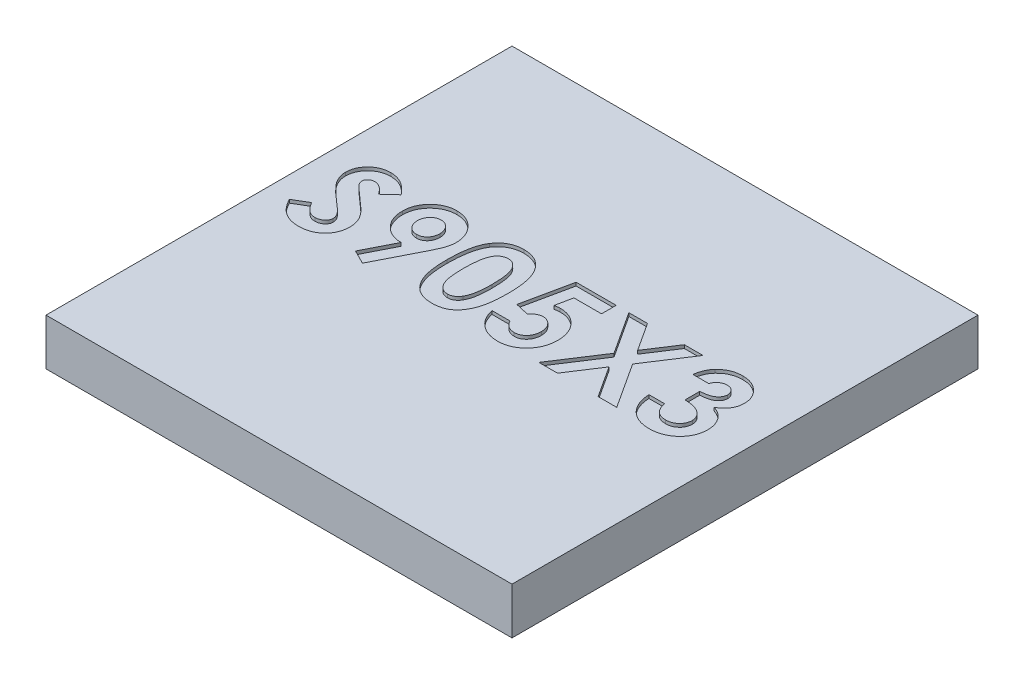
from build123d import *

# Parameters (mm, degrees)
ESQUISSE1_W             = 14
ESQUISSE1_H             = 14
BOSS_EXTRU_1_DEPTH      = 1.4
ENL_V_MAT_EXTRU_1_DEPTH = 0.1


with BuildPart() as part:
    # Esquisse1 → Boss.-Extru.1 (new body)
    with BuildSketch(Plane(origin=(0, 0, 0), x_dir=(1, 0, 0), z_dir=(0, 1, 0))):
        with Locations((7, 7)):
            Rectangle(ESQUISSE1_W, ESQUISSE1_H)
    extrude(amount=BOSS_EXTRU_1_DEPTH)

    # Esquisse2 → Enlèv. mat.-Extru.1 (cut)
    # profile 1 of 6: a face of its own
    with BuildSketch(Plane(origin=(0, 1.4, 0), x_dir=(1, 0, 0), z_dir=(0, 1, 0))):
        with BuildLine():
            Line((2.20538927, 8.465128817), (1.850279428, 8.140229812))
            add(Edge.make_bspline(
                [(1.850279428, 8.140229812), (1.835068045, 8.161687049), (1.805864311, 8.202881952), (1.758528104, 8.258042898), (1.711405644, 8.30509929), (1.664060371, 8.343854548), (1.616072634, 8.374073205), (1.567525732, 8.395468348), (1.518694891, 8.409069443), (1.485888104, 8.410763107), (1.46972888, 8.411597333)],
                knots=[0, 0, 0, 0, 1.299362458, 2.494594718, 3.587462134, 4.587049575, 5.512617175, 6.380583204, 7.202344345, 8, 8, 8, 8], degree=3))
            add(Edge.make_bspline(
                [(1.46972888, 8.411597333), (1.454656019, 8.411068729), (1.425554285, 8.410048133), (1.384067604, 8.399903488), (1.347235137, 8.382395319), (1.315092833, 8.359501915), (1.289631385, 8.331920671), (1.269302394, 8.302995038), (1.257855463, 8.271067681), (1.256348822, 8.249138684), (1.255602945, 8.23828253)],
                knots=[0, 0, 0, 0, 1.185010067, 2.2879431, 3.333075148, 4.379039566, 5.372662701, 6.27520591, 7.14612461, 8, 8, 8, 8], degree=3))
            add(Edge.make_bspline(
                [(1.255602945, 8.23828253), (1.256070349, 8.227269825), (1.257011634, 8.205091768), (1.266103166, 8.172587063), (1.279806701, 8.140826182), (1.292900988, 8.121491823), (1.299594165, 8.111609019)],
                knots=[0, 0, 0, 0, 0.967525499, 1.948461899, 2.951351359, 4, 4, 4, 4], degree=3))
            add(Edge.make_bspline(
                [(1.299594165, 8.111609019), (1.305678986, 8.103927218), (1.319685441, 8.086244728), (1.346392883, 8.058238421), (1.379931821, 8.023928242), (1.421592903, 7.98449402), (1.469646665, 7.938517544), (1.526320459, 7.887806168), (1.589982967, 7.83078942), (1.635232803, 7.791085021), (1.658944125, 7.770279558)],
                knots=[0, 0, 0, 0, 0.473873513, 1.090794244, 1.870441696, 2.795289791, 3.865433203, 5.087734844, 6.473946851, 8, 8, 8, 8], degree=3))
            add(Edge.make_bspline(
                [(1.658944125, 7.770279558), (1.68120061, 7.751017692), (1.723438796, 7.714462673), (1.783535347, 7.662578692), (1.836350207, 7.615899939), (1.882652766, 7.575126963), (1.921741125, 7.539831962), (1.953779609, 7.509846226), (1.979159516, 7.485753522), (1.993586507, 7.471201514), (1.99974357, 7.464991097)],
                knots=[0, 0, 0, 0, 1.543621617, 2.929473131, 4.163658386, 5.240097082, 6.164993805, 6.925417477, 7.541396219, 8, 8, 8, 8], degree=3))
            add(Edge.make_bspline(
                [(1.99974357, 7.464991097), (2.023102185, 7.439712073), (2.068005645, 7.391116912), (2.126364314, 7.315809696), (2.174395386, 7.242294497), (2.211553134, 7.169188009), (2.23961616, 7.095435449), (2.259400965, 7.019228041), (2.271250216, 6.939769464), (2.27256576, 6.885548685), (2.27323115, 6.858124276)],
                knots=[0, 0, 0, 0, 1.206664779, 2.319633467, 3.337109185, 4.282041471, 5.190008762, 6.099243693, 7.03861361, 8, 8, 8, 8], degree=3))
            add(Edge.make_bspline(
                [(2.27323115, 6.858124276), (2.272757542, 6.831402553), (2.271828306, 6.778973537), (2.260446938, 6.702251482), (2.244217775, 6.628825146), (2.219124643, 6.559493511), (2.188541282, 6.493118518), (2.150200622, 6.430734081), (2.105174774, 6.371708842), (2.053568238, 6.31709795), (1.996485282, 6.26754235), (1.935258387, 6.223426785), (1.869288845, 6.187003767), (1.799140289, 6.15701201), (1.724850269, 6.133911957), (1.646507286, 6.116838865), (1.56399151, 6.106591865), (1.507566033, 6.105520662), (1.47873913, 6.104973402)],
                knots=[0, 0, 0, 0, 1.043214005, 2.046824704, 3.02475056, 3.976699089, 4.921714032, 5.875962561, 6.831408892, 7.817874052, 8.806269674, 9.781291748, 10.760897367, 11.74438705, 12.757449933, 13.795994037, 14.874007457, 16, 16, 16, 16], degree=3))
            add(Edge.make_bspline(
                [(1.47873913, 6.104973402), (1.456110256, 6.105374853), (1.411292109, 6.106169957), (1.345236936, 6.112661317), (1.2814532, 6.123137683), (1.220012746, 6.138153444), (1.160638775, 6.15718045), (1.103328849, 6.180421209), (1.048478597, 6.208235943), (0.995672995, 6.240052673), (0.945168745, 6.276996086), (0.89632724, 6.318310888), (0.849633621, 6.364632519), (0.804863626, 6.415851429), (0.762303707, 6.472112659), (0.720560726, 6.532632666), (0.681489866, 6.598534621), (0.657354057, 6.644765374), (0.645026022, 6.668379017)],
                knots=[0, 0, 0, 0, 1.016823716, 2.013894106, 2.979844003, 3.91962641, 4.853723003, 5.779685073, 6.695824784, 7.614987388, 8.547259901, 9.504950863, 10.487499108, 11.500346958, 12.559593716, 13.656357062, 14.802919212, 16, 16, 16, 16], degree=3))
            Line((0.645026022, 6.668379017), (1.062677598, 6.919075966))
            add(Edge.make_bspline(
                [(1.062677598, 6.919075966), (1.078098128, 6.892271396), (1.1076606, 6.840884744), (1.157756975, 6.771840265), (1.209078152, 6.712715098), (1.262810633, 6.664554283), (1.318301051, 6.62671385), (1.375817436, 6.59967045), (1.4354002, 6.582930617), (1.475985272, 6.580886297), (1.496229615, 6.579866564)],
                knots=[0, 0, 0, 0, 1.283663364, 2.460892379, 3.537111102, 4.529833553, 5.449777664, 6.316464042, 7.160231139, 8, 8, 8, 8], degree=3))
            add(Edge.make_bspline(
                [(1.496229615, 6.579866564), (1.51682101, 6.580699333), (1.556771315, 6.582315026), (1.613795264, 6.597238696), (1.66607698, 6.620669952), (1.711268909, 6.654103123), (1.749534585, 6.692690084), (1.77777685, 6.735619842), (1.795518832, 6.782068805), (1.797394589, 6.81433531), (1.798337988, 6.830563512)],
                knots=[0, 0, 0, 0, 1.13588714, 2.203786484, 3.234766741, 4.283437687, 5.291419208, 6.222934724, 7.106237994, 8, 8, 8, 8], degree=3))
            add(Edge.make_bspline(
                [(1.798337988, 6.830563512), (1.797466798, 6.845661214), (1.795697059, 6.876330751), (1.782661707, 6.92193142), (1.762283475, 6.96751135), (1.738174589, 7.004897242), (1.71364078, 7.036199436), (1.690180924, 7.063321371), (1.661613026, 7.093286362), (1.628009521, 7.1261321), (1.589814398, 7.162147737), (1.546995484, 7.201329746), (1.499062457, 7.243332978), (1.465183299, 7.271945166), (1.447468263, 7.286906161)],
                knots=[0, 0, 0, 0, 0.916159276, 1.861089862, 2.860218735, 3.940849679, 4.552606315, 5.27541173, 6.11797699, 7.06649574, 8.129236253, 9.306560635, 10.591630461, 12, 12, 12, 12], degree=3))
            add(Edge.make_bspline(
                [(1.447468263, 7.286906161), (1.413791275, 7.315400122), (1.349154942, 7.370088658), (1.257815603, 7.450861904), (1.17551068, 7.526351903), (1.102951047, 7.597491878), (1.039212181, 7.662968037), (0.984725751, 7.723312203), (0.940090315, 7.778989848), (0.893121142, 7.844936294), (0.848491037, 7.925296569), (0.809917962, 8.021979295), (0.784893379, 8.118649754), (0.782089722, 8.183548976), (0.780709783, 8.215491898)],
                knots=[0, 0, 0, 0, 1.345494975, 2.582412109, 3.71882943, 4.751509156, 5.681369928, 6.505683931, 7.230279997, 7.856715994, 8.973648664, 10.023341002, 11.027102913, 12, 12, 12, 12], degree=3))
            add(Edge.make_bspline(
                [(0.780709783, 8.215491898), (0.781283698, 8.238144103), (0.782414372, 8.282771382), (0.792500158, 8.348389292), (0.80757375, 8.411705062), (0.829464932, 8.472487687), (0.857877044, 8.530661035), (0.89238245, 8.586509887), (0.933516954, 8.639520225), (0.979872763, 8.689656905), (1.030944996, 8.735476126), (1.085522167, 8.775916179), (1.143295365, 8.810072436), (1.203911163, 8.838407531), (1.267745171, 8.860096246), (1.334327127, 8.875470289), (1.403752531, 8.884614279), (1.450974192, 8.885857298), (1.475029027, 8.886490496)],
                knots=[0, 0, 0, 0, 1.010766082, 1.991317756, 2.957454644, 3.913069143, 4.869106762, 5.843196583, 6.838735724, 7.860187025, 8.887984031, 9.89767229, 10.887916223, 11.879572884, 12.879850636, 13.892031539, 14.926195476, 16, 16, 16, 16], degree=3))
            add(Edge.make_bspline(
                [(1.475029027, 8.886490496), (1.506202903, 8.885350089), (1.568304578, 8.883078277), (1.660123696, 8.865313453), (1.749808772, 8.837376395), (1.822078687, 8.803673409), (1.879582509, 8.77102531), (1.923653817, 8.740967054), (1.968498746, 8.706533705), (2.014478941, 8.667616756), (2.060740019, 8.62348296), (2.108597404, 8.575182957), (2.157398981, 8.522299322), (2.189112269, 8.484519498), (2.20538927, 8.465128817)],
                knots=[0, 0, 0, 0, 1.282922637, 2.555718331, 3.837320111, 5.142675274, 5.830281639, 6.55870424, 7.337177975, 8.157850921, 9.037902056, 9.96903443, 10.957596896, 12, 12, 12, 12], degree=3))
        make_face()
    # profile 2 of 6: a face of its own
    with BuildSketch(Plane(origin=(0, 1.4, 0), x_dir=(1, 0, 0), z_dir=(0, 1, 0))):
        with BuildLine():
            Line((3.40322247, 6.104973402), (2.982390806, 6.316979278))
            Line((2.982390806, 6.316979278), (3.443503586, 7.224364427))
            add(Edge.make_bspline(
                [(3.443503586, 7.224364427), (3.416259985, 7.22505883), (3.362774203, 7.226422112), (3.284020563, 7.237750969), (3.208710352, 7.25709005), (3.135955913, 7.282835239), (3.066763415, 7.317349333), (3.000293845, 7.358540093), (2.937467365, 7.408030198), (2.877989409, 7.463659123), (2.823684135, 7.525147092), (2.776548306, 7.591276362), (2.735464009, 7.660369427), (2.703514606, 7.733986113), (2.677852683, 7.810754388), (2.659102788, 7.891071613), (2.648580843, 7.975290169), (2.647110173, 8.032608396), (2.646361492, 8.061787638)],
                knots=[0, 0, 0, 0, 1.014336294, 1.991387562, 2.955278539, 3.906441712, 4.859855302, 5.829322156, 6.813833455, 7.833278715, 8.858926674, 9.863225732, 10.85404919, 11.846815163, 12.845559416, 13.865450493, 14.913355531, 16, 16, 16, 16], degree=3))
            add(Edge.make_bspline(
                [(2.646361492, 8.061787638), (2.647055934, 8.090091214), (2.648424318, 8.145862826), (2.659788874, 8.227717403), (2.678491993, 8.306309755), (2.704152003, 8.381626531), (2.738312005, 8.453159857), (2.778295418, 8.522029779), (2.827173326, 8.586811452), (2.882388734, 8.647785316), (2.942819068, 8.703565636), (3.00693058, 8.752610169), (3.074431763, 8.793606685), (3.144455162, 8.828036196), (3.218266499, 8.853759785), (3.294799119, 8.873168042), (3.374623138, 8.884369381), (3.428806018, 8.8857778), (3.456223939, 8.886490496)],
                knots=[0, 0, 0, 0, 1.055538678, 2.079917126, 3.075849687, 4.065898488, 5.041806164, 6.028602842, 7.031727914, 8.062953097, 9.093756959, 10.095582084, 11.068815425, 12.035667573, 13.000833448, 13.979119574, 14.977382875, 16, 16, 16, 16], degree=3))
            add(Edge.make_bspline(
                [(3.456223939, 8.886490496), (3.484892692, 8.88590038), (3.541265917, 8.884739998), (3.623788747, 8.871935642), (3.702743251, 8.852291417), (3.778450233, 8.825610553), (3.849969824, 8.789399097), (3.917900462, 8.745999415), (3.982016188, 8.69445126), (4.041628447, 8.63624041), (4.09584513, 8.57292522), (4.143901473, 8.50664949), (4.184270842, 8.437542808), (4.217335825, 8.366221928), (4.24309328, 8.292575116), (4.260798247, 8.216497909), (4.272552382, 8.1381204), (4.273889768, 8.084974657), (4.274566621, 8.058077535)],
                knots=[0, 0, 0, 0, 1.062826075, 2.08990367, 3.089830715, 4.078784409, 5.060762809, 6.057138927, 7.064407536, 8.107320944, 9.143871033, 10.153461498, 11.140480137, 12.108246174, 13.065926856, 14.029354859, 15.002654194, 16, 16, 16, 16], degree=3))
            add(Edge.make_bspline(
                [(4.274566621, 8.058077535), (4.274197256, 8.037563738), (4.273453272, 7.996244339), (4.26613786, 7.934281422), (4.255038905, 7.872146768), (4.242156218, 7.819906935), (4.228650514, 7.775871929), (4.215507925, 7.738516393), (4.198645597, 7.697044733), (4.179817122, 7.651178976), (4.158011532, 7.601120248), (4.132776729, 7.547107849), (4.105637834, 7.488340721), (4.085633789, 7.448156561), (4.075281097, 7.427360054)],
                knots=[0, 0, 0, 0, 1.105131805, 2.225983929, 3.357782449, 4.505488967, 5.122909461, 5.839607681, 6.638776516, 7.535249922, 8.51168636, 9.581005249, 10.748097757, 12, 12, 12, 12], degree=3))
            Line((4.075281097, 7.427360054), (3.40322247, 6.104973402))
        make_face()
        with BuildLine():
            add(Edge.make_bspline(
                [(3.466824233, 7.665336649), (3.489579135, 7.666676296), (3.53403706, 7.669293663), (3.597897915, 7.689531702), (3.655050132, 7.724164483), (3.705706217, 7.770174593), (3.747566855, 7.826309033), (3.778002279, 7.890213102), (3.796749562, 7.960563419), (3.798680105, 8.009550675), (3.799673458, 8.034756889)],
                knots=[0, 0, 0, 0, 0.984774978, 1.924027336, 2.867853169, 3.859505234, 4.871392407, 5.881338128, 6.909850265, 8, 8, 8, 8], degree=3))
            add(Edge.make_bspline(
                [(3.799673458, 8.034756889), (3.798477072, 8.06048745), (3.796149816, 8.110539535), (3.777222941, 8.182578529), (3.744880718, 8.247697506), (3.700880974, 8.304303831), (3.649511846, 8.351676093), (3.592068196, 8.386280255), (3.529944873, 8.40767836), (3.48695336, 8.410281988), (3.465234189, 8.411597333)],
                knots=[0, 0, 0, 0, 1.104110315, 2.147758178, 3.172670271, 4.206310416, 5.210906102, 6.157051016, 7.068948237, 8, 8, 8, 8], degree=3))
            add(Edge.make_bspline(
                [(3.465234189, 8.411597333), (3.442278244, 8.410315042), (3.397204435, 8.407797273), (3.332550402, 8.386450555), (3.272949534, 8.352510908), (3.220901449, 8.304977914), (3.175855828, 8.249117076), (3.144444287, 8.183778293), (3.124572257, 8.112242016), (3.122380406, 8.062100171), (3.121254655, 8.036346933)],
                knots=[0, 0, 0, 0, 0.970967322, 1.90648639, 2.855811969, 3.858352357, 4.877096915, 5.878517833, 6.91039038, 8, 8, 8, 8], degree=3))
            add(Edge.make_bspline(
                [(3.121254655, 8.036346933), (3.122430572, 8.010960788), (3.124717608, 7.961587386), (3.143885293, 7.890838086), (3.175107533, 7.826595831), (3.217790562, 7.770018691), (3.270365543, 7.723781884), (3.330060385, 7.689518013), (3.396648602, 7.669238788), (3.443011276, 7.666660777), (3.466824233, 7.665336649)],
                knots=[0, 0, 0, 0, 1.075706617, 2.092137047, 3.084482865, 4.090466434, 5.0784141, 6.035155512, 6.990809768, 8, 8, 8, 8], degree=3))
        make_face(mode=Mode.SUBTRACT)
    # profile 3 of 6: a face of its own
    with BuildSketch(Plane(origin=(0, 1.4, 0), x_dir=(1, 0, 0), z_dir=(0, 1, 0))):
        with BuildLine():
            add(Edge.make_bspline(
                [(5.470809776, 8.886490496), (5.493796576, 8.88614925), (5.538994767, 8.88547827), (5.605563194, 8.878211012), (5.669686994, 8.867232211), (5.731617028, 8.851920612), (5.790907516, 8.831656256), (5.847989988, 8.807400169), (5.902184996, 8.77788007), (5.954183701, 8.744535602), (6.003966071, 8.706784937), (6.050335624, 8.66374723), (6.094139165, 8.61641278), (6.134428508, 8.564065975), (6.172095875, 8.507182965), (6.207017496, 8.44575473), (6.238926037, 8.37948062), (6.268179117, 8.308241038), (6.294337314, 8.230968134), (6.31637033, 8.146775554), (6.335267329, 8.05564407), (6.351217729, 7.957346844), (6.363273653, 7.851753213), (6.371399589, 7.738933331), (6.376975991, 7.619104696), (6.377431098, 7.536903237), (6.377664911, 7.494671919)],
                knots=[0, 0, 0, 0, 0.879237366, 1.728815576, 2.559023295, 3.367336655, 4.166867292, 4.954216142, 5.737608147, 6.525189134, 7.316157332, 8.124696809, 8.942788509, 9.781158001, 10.649253743, 11.551476218, 12.482711956, 13.461909668, 14.496590415, 15.601789533, 16.789733467, 18.056700938, 19.410929216, 20.8549011, 22.384193279, 24, 24, 24, 24], degree=3))
            add(Edge.make_bspline(
                [(6.377664911, 7.494671919), (6.377412222, 7.451912241), (6.376921253, 7.368830952), (6.371631402, 7.247906303), (6.362522029, 7.134267281), (6.350781211, 7.02792564), (6.334699502, 6.92893754), (6.315865586, 6.837046667), (6.293484785, 6.752286329), (6.266464946, 6.67484751), (6.237388935, 6.603482816), (6.20539311, 6.537337925), (6.171035154, 6.47623368), (6.135103135, 6.41924824), (6.095627127, 6.368061507), (6.054528538, 6.320932865), (6.010017864, 6.279657504), (5.963969174, 6.242108277), (5.91469552, 6.20965821), (5.862705048, 6.181277916), (5.807070858, 6.158258127), (5.748807067, 6.138236744), (5.686920556, 6.123863551), (5.622394693, 6.112458895), (5.554500996, 6.106155983), (5.508276232, 6.105374065), (5.484590158, 6.104973402)],
                knots=[0, 0, 0, 0, 1.643780988, 3.193836972, 4.651895693, 6.025988579, 7.305620092, 8.505800249, 9.631074763, 10.672816429, 11.65661981, 12.592235626, 13.49536222, 14.350718032, 15.179365177, 15.97804903, 16.751647189, 17.51006938, 18.259804725, 19.016521909, 19.783502495, 20.571750527, 21.382245291, 22.22305063, 23.089471752, 24, 24, 24, 24], degree=3))
            add(Edge.make_bspline(
                [(5.484590158, 6.104973402), (5.460904724, 6.105381793), (5.414505307, 6.106181827), (5.346428018, 6.11241203), (5.281560201, 6.123909752), (5.219184068, 6.138347091), (5.159733748, 6.158213828), (5.102924177, 6.181922352), (5.049192173, 6.210125567), (4.998388959, 6.24265124), (4.950687993, 6.279949235), (4.905348002, 6.321620606), (4.86246928, 6.367559728), (4.822704119, 6.418281158), (4.78540128, 6.47310787), (4.750949775, 6.532665957), (4.719370306, 6.596868706), (4.689675062, 6.665805609), (4.663873654, 6.740960796), (4.640911599, 6.823005396), (4.622101688, 6.912623317), (4.606973499, 7.009785769), (4.594895161, 7.114286908), (4.585910266, 7.226177175), (4.580591032, 7.345508685), (4.580105211, 7.427531176), (4.579855082, 7.469761229)],
                knots=[0, 0, 0, 0, 0.917216111, 1.796812873, 2.643793957, 3.46689424, 4.273913431, 5.068098542, 5.848489301, 6.620921603, 7.401012384, 8.190319798, 9.003608147, 9.831726257, 10.68377682, 11.569763213, 12.493818149, 13.453288342, 14.474581811, 15.568529029, 16.750744269, 18.018426408, 19.375425659, 20.823733699, 22.36466933, 24, 24, 24, 24], degree=3))
            add(Edge.make_bspline(
                [(4.579855082, 7.469761229), (4.580308168, 7.528436563), (4.581182403, 7.641651377), (4.592261354, 7.805213866), (4.608522445, 7.956399053), (4.632406134, 8.094954044), (4.661937986, 8.221392006), (4.69975506, 8.334880031), (4.742807048, 8.436988481), (4.779492873, 8.497478142), (4.797161105, 8.526610521)],
                knots=[0, 0, 0, 0, 1.288568992, 2.486310467, 3.599230591, 4.627010532, 5.572937695, 6.447898582, 7.252493626, 8, 8, 8, 8], degree=3))
            add(Edge.make_bspline(
                [(4.797161105, 8.526610521), (4.817704884, 8.555230161), (4.857872019, 8.611187197), (4.928105377, 8.684648325), (5.003561976, 8.747475879), (5.085791652, 8.798248016), (5.173493908, 8.838286927), (5.267421712, 8.866565958), (5.367228205, 8.88304264), (5.435766988, 8.885324048), (5.470809776, 8.886490496)],
                knots=[0, 0, 0, 0, 1.058512271, 2.069600068, 3.047294572, 4.004278952, 4.967380941, 5.939006123, 6.946246673, 8, 8, 8, 8], degree=3))
        make_face()
        with BuildLine():
            add(Edge.make_bspline(
                [(5.482470099, 8.411597333), (5.461689842, 8.41061239), (5.420949505, 8.408681379), (5.361833336, 8.392289821), (5.30609048, 8.366972175), (5.263688378, 8.336506346), (5.231950826, 8.307301196), (5.209775571, 8.280871485), (5.188391033, 8.251377833), (5.169503131, 8.217489341), (5.151668022, 8.180423665), (5.134237745, 8.140012548), (5.119949494, 8.095263405), (5.105911667, 8.04693832), (5.09361322, 7.993701233), (5.083309818, 7.93511699), (5.074104634, 7.870804612), (5.067683908, 7.800721974), (5.061697865, 7.7249424), (5.057406785, 7.643297082), (5.055612793, 7.555808046), (5.055042537, 7.495555646), (5.054748244, 7.464461082)],
                knots=[0, 0, 0, 0, 1.076674018, 2.110852608, 3.161083442, 4.239746716, 4.804137807, 5.395870207, 6.026861976, 6.692161227, 7.405688833, 8.16177676, 8.973626916, 9.841385931, 10.773283133, 11.807421078, 12.927755683, 14.143907515, 15.458935494, 16.872852025, 18.386167141, 20, 20, 20, 20], degree=3))
            add(Edge.make_bspline(
                [(5.054748244, 7.464461082), (5.055232615, 7.424176571), (5.056161431, 7.346928034), (5.061026135, 7.235841948), (5.070777031, 7.134744665), (5.082905176, 7.042951011), (5.099939652, 6.961056293), (5.119538918, 6.88828571), (5.14374227, 6.825566911), (5.171713907, 6.771992841), (5.202693755, 6.72641749), (5.236323742, 6.687678237), (5.271458889, 6.654131872), (5.309195877, 6.626882573), (5.349444678, 6.605999966), (5.391869287, 6.590979365), (5.436496665, 6.581784629), (5.467057034, 6.580509615), (5.482470099, 6.579866564)],
                knots=[0, 0, 0, 0, 1.771748488, 3.397459088, 4.888034009, 6.237357457, 7.467047327, 8.564189669, 9.548206622, 10.417051504, 11.216568818, 11.965764335, 12.669334354, 13.348544111, 14.005342236, 14.656555988, 15.322436492, 16, 16, 16, 16], degree=3))
            add(Edge.make_bspline(
                [(5.482470099, 6.579866564), (5.497354237, 6.580306587), (5.526495529, 6.581168098), (5.568990058, 6.590011392), (5.609175904, 6.604388668), (5.646931734, 6.624726333), (5.682392595, 6.650588786), (5.715385176, 6.682089678), (5.745660653, 6.719542999), (5.763299284, 6.747338902), (5.772388135, 6.761661603)],
                knots=[0, 0, 0, 0, 0.992283464, 1.942767638, 2.88273346, 3.832339453, 4.79467288, 5.803907806, 6.868395428, 8, 8, 8, 8], degree=3))
            add(Edge.make_bspline(
                [(5.772388135, 6.761661603), (5.783088726, 6.781233115), (5.805526999, 6.82227299), (5.831492607, 6.891526249), (5.853349008, 6.969632479), (5.872160493, 7.056834754), (5.885026401, 7.15347701), (5.896106506, 7.258946432), (5.901450715, 7.373774119), (5.90231998, 7.453327155), (5.902771749, 7.494671919)],
                knots=[0, 0, 0, 0, 0.710965849, 1.490837728, 2.352621235, 3.297892224, 4.334225155, 5.461620853, 6.680770821, 8, 8, 8, 8], degree=3))
            add(Edge.make_bspline(
                [(5.902771749, 7.494671919), (5.90259724, 7.536375576), (5.902261342, 7.616647995), (5.896098571, 7.731888496), (5.887516441, 7.837141568), (5.874963263, 7.932172223), (5.858811318, 8.017211155), (5.838903985, 8.092252804), (5.81543472, 8.157445063), (5.787602969, 8.212722926), (5.756777575, 8.259701526), (5.724055479, 8.300005522), (5.689298317, 8.334416056), (5.652564216, 8.363062622), (5.613002951, 8.384950748), (5.571370195, 8.400405575), (5.527580596, 8.409755227), (5.497709891, 8.41097501), (5.482470099, 8.411597333)],
                knots=[0, 0, 0, 0, 1.793836731, 3.452829483, 4.963243077, 6.335886805, 7.574563692, 8.684454726, 9.672768357, 10.54971625, 11.340229787, 12.085688095, 12.778991901, 13.440269426, 14.083255152, 14.715733572, 15.344777694, 16, 16, 16, 16], degree=3))
        make_face(mode=Mode.SUBTRACT)
    # profile 4 of 6: a face of its own
    with BuildSketch(Plane(origin=(0, 1.4, 0), x_dir=(1, 0, 0), z_dir=(0, 1, 0))):
        with BuildLine():
            Line((7.10643511, 8.818648615), (8.311158501, 8.818648615))
            Line((8.311158501, 8.818648615), (8.311158501, 8.377676393))
            Line((8.311158501, 8.377676393), (7.48274554, 8.377676393))
            Line((7.48274554, 8.377676393), (7.379392676, 7.877342526))
            add(Edge.make_bspline(
                [(7.379392676, 7.877342526), (7.393475983, 7.881264904), (7.421251158, 7.889000641), (7.463094495, 7.896758607), (7.503646519, 7.901787073), (7.53025651, 7.902457804), (7.543167215, 7.902783231)],
                knots=[0, 0, 0, 0, 1.05461699, 2.079921384, 3.068411212, 4, 4, 4, 4], degree=3))
            add(Edge.make_bspline(
                [(7.543167215, 7.902783231), (7.571300994, 7.902138561), (7.62675887, 7.900867776), (7.707886706, 7.888803881), (7.785571402, 7.869803611), (7.859575233, 7.842705305), (7.929825908, 7.807436161), (7.996408585, 7.764770384), (8.059404982, 7.714633036), (8.117696019, 7.656992727), (8.171256259, 7.593702364), (8.217823833, 7.525247138), (8.257595447, 7.452603157), (8.289228413, 7.375318865), (8.314195847, 7.293879661), (8.332237873, 7.208233355), (8.342907024, 7.118278444), (8.344345693, 7.05690864), (8.345079441, 7.025608918)],
                knots=[0, 0, 0, 0, 1.01440847, 1.999622559, 2.951875003, 3.895578053, 4.836219714, 5.782137149, 6.743708247, 7.735272588, 8.734977101, 9.730283169, 10.717124674, 11.717316708, 12.737475749, 13.78628267, 14.87096371, 16, 16, 16, 16], degree=3))
            add(Edge.make_bspline(
                [(8.345079441, 7.025608918), (8.344182789, 6.993953873), (8.342413434, 6.931489214), (8.330870009, 6.83964407), (8.310495658, 6.751677157), (8.282509447, 6.667352989), (8.245639407, 6.587291329), (8.201298137, 6.510662796), (8.148735946, 6.438036182), (8.08846865, 6.370155995), (8.022950193, 6.308112202), (7.953188503, 6.253532158), (7.879673676, 6.207603494), (7.802403939, 6.170485368), (7.721822612, 6.141118167), (7.637905239, 6.119740247), (7.550243991, 6.107481198), (7.490733394, 6.10581852), (7.460484923, 6.104973402)],
                knots=[0, 0, 0, 0, 1.06808661, 2.107647099, 3.116961351, 4.110378221, 5.100014249, 6.085620622, 7.093190682, 8.119403071, 9.144090782, 10.133780668, 11.103064255, 12.062861538, 13.020824475, 13.992378307, 14.979551724, 16, 16, 16, 16], degree=3))
            add(Edge.make_bspline(
                [(7.460484923, 6.104973402), (7.433434616, 6.105664761), (7.380085749, 6.107028265), (7.301505211, 6.115409084), (7.225744845, 6.13022645), (7.153206858, 6.151671016), (7.083128028, 6.17806438), (7.016318486, 6.211074271), (6.952411102, 6.250072134), (6.89158735, 6.294346258), (6.834835529, 6.344219342), (6.78303848, 6.398814025), (6.735882617, 6.457442167), (6.694377002, 6.520827063), (6.658651743, 6.588875065), (6.626969855, 6.66078421), (6.601037912, 6.737305461), (6.587878198, 6.790354243), (6.581190552, 6.817313145)],
                knots=[0, 0, 0, 0, 1.054957082, 2.080596141, 3.077793124, 4.061112343, 5.027190972, 5.994718051, 6.962465889, 7.943658696, 8.924948258, 9.904494768, 10.875059, 11.855380583, 12.854004648, 13.869083016, 14.917087635, 16, 16, 16, 16], degree=3))
            Line((6.581190552, 6.817313145), (7.123925595, 6.817313145))
            add(Edge.make_bspline(
                [(7.123925595, 6.817313145), (7.133846805, 6.798631724), (7.153127543, 6.762326513), (7.189803771, 6.714125892), (7.23086048, 6.673022472), (7.275927315, 6.638614665), (7.325296283, 6.612836922), (7.37695569, 6.593288274), (7.431554512, 6.581991835), (7.468738721, 6.580579668), (7.487515672, 6.579866564)],
                knots=[0, 0, 0, 0, 1.104910296, 2.147267069, 3.153527244, 4.136738762, 5.099945312, 6.05603338, 7.018353, 8, 8, 8, 8], degree=3))
            add(Edge.make_bspline(
                [(7.487515672, 6.579866564), (7.500602956, 6.580358968), (7.526352406, 6.581327782), (7.564290149, 6.586453049), (7.600503392, 6.596160188), (7.635261371, 6.609602319), (7.668657455, 6.626366175), (7.7002129, 6.647529451), (7.730476713, 6.671889166), (7.758988156, 6.699842022), (7.784811306, 6.731002954), (7.807455383, 6.7644875), (7.827702311, 6.799551626), (7.842699521, 6.837584309), (7.854980967, 6.877449881), (7.86402552, 6.91944906), (7.869430661, 6.963630897), (7.869931033, 6.993792599), (7.870186279, 7.009178463)],
                knots=[0, 0, 0, 0, 0.978869489, 1.925942215, 2.855067702, 3.774946051, 4.70828698, 5.642468714, 6.60995405, 7.609372294, 8.622401667, 9.629904756, 10.629323, 11.642352373, 12.678539694, 13.745912462, 14.850161547, 16, 16, 16, 16], degree=3))
            add(Edge.make_bspline(
                [(7.870186279, 7.009178463), (7.869890036, 7.024207186), (7.869313394, 7.053460961), (7.86454329, 7.096415981), (7.856009666, 7.13717252), (7.844382529, 7.176042745), (7.829498407, 7.212790616), (7.811309015, 7.247634874), (7.789736645, 7.280399393), (7.764665481, 7.310417122), (7.73792985, 7.337950236), (7.709207191, 7.362030478), (7.678756281, 7.382015408), (7.647523343, 7.399462832), (7.614261671, 7.412160688), (7.579719188, 7.420905232), (7.543932218, 7.427321627), (7.519522702, 7.427698614), (7.507126216, 7.427890068)],
                knots=[0, 0, 0, 0, 1.166249705, 2.270133367, 3.348514167, 4.393962215, 5.415026464, 6.420877785, 7.440098956, 8.453121383, 9.451844239, 10.415694839, 11.355045125, 12.27538808, 13.187007209, 14.108269027, 15.039275622, 16, 16, 16, 16], degree=3))
            add(Edge.make_bspline(
                [(7.507126216, 7.427890068), (7.493660751, 7.427379129), (7.46667307, 7.426355096), (7.426576131, 7.418022817), (7.38696265, 7.404538063), (7.347612334, 7.385933708), (7.308915805, 7.361586478), (7.269851841, 7.333029969), (7.231727998, 7.298189278), (7.207487797, 7.272239853), (7.194947563, 7.258815382)],
                knots=[0, 0, 0, 0, 0.88288272, 1.769486374, 2.674910571, 3.623812639, 4.617874466, 5.670434592, 6.794841017, 8, 8, 8, 8], degree=3))
            Line((7.194947563, 7.258815382), (6.795316487, 7.350507924))
            Line((6.795316487, 7.350507924), (7.10643511, 8.818648615))
        make_face()
    # profile 5 of 6: a face of its own
    with BuildSketch(Plane(origin=(0, 1.4, 0), x_dir=(1, 0, 0), z_dir=(0, 1, 0))):
        Polygon((8.692239063, 8.818648615), (9.251934576, 8.818648615), (9.804739898, 7.969035067), (10.358605249, 8.818648615), (10.918830777, 8.818648615), (10.084587654, 7.539193153), (10.973952304, 6.172815282), (10.414256791, 6.172815282), (9.804739898, 7.109881254), (9.19363296, 6.172815282), (8.633407433, 6.172815282), (9.524892141, 7.539723168), align=None)
    # profile 6 of 6: a face of its own
    with BuildSketch(Plane(origin=(0, 1.4, 0), x_dir=(1, 0, 0), z_dir=(0, 1, 0))):
        with BuildLine():
            Line((11.737173458, 8.174150752), (11.262280296, 8.174150752))
            add(Edge.make_bspline(
                [(11.262280296, 8.174150752), (11.265633222, 8.197888967), (11.272206412, 8.244426165), (11.287935177, 8.311800435), (11.306748476, 8.375709541), (11.33023592, 8.435951096), (11.35778287, 8.49263241), (11.389109205, 8.545947985), (11.424553574, 8.595668982), (11.451722059, 8.625621108), (11.465275922, 8.640563679)],
                knots=[0, 0, 0, 0, 1.111473889, 2.178970933, 3.205615836, 4.199322666, 5.174200091, 6.12565194, 7.064921805, 8, 8, 8, 8], degree=3))
            add(Edge.make_bspline(
                [(11.465275922, 8.640563679), (11.484825574, 8.66027932), (11.523355883, 8.699136775), (11.587744549, 8.748908882), (11.655235762, 8.791983257), (11.727183088, 8.826132932), (11.802466973, 8.853773138), (11.881686099, 8.872339127), (11.964516749, 8.884657825), (12.021038247, 8.885871259), (12.049882125, 8.886490496)],
                knots=[0, 0, 0, 0, 1.01925491, 2.00884431, 2.983262333, 3.955970413, 4.92937149, 5.924503185, 6.940838805, 8, 8, 8, 8], degree=3))
            add(Edge.make_bspline(
                [(12.049882125, 8.886490496), (12.075525817, 8.885885098), (12.125936148, 8.884695009), (12.200026651, 8.875141619), (12.270665745, 8.858386038), (12.338600106, 8.83647849), (12.402830641, 8.806669611), (12.46477498, 8.772067847), (12.522702396, 8.729627345), (12.576748428, 8.681673849), (12.626400017, 8.629807448), (12.66939851, 8.574366532), (12.706365087, 8.516832054), (12.736820656, 8.456726011), (12.76023685, 8.393946698), (12.776488384, 8.328856782), (12.787125407, 8.261599888), (12.788185132, 8.215886283), (12.788722603, 8.192701266)],
                knots=[0, 0, 0, 0, 1.091422571, 2.145516843, 3.172569842, 4.178562979, 5.178154469, 6.181868002, 7.194278174, 8.227918432, 9.254613415, 10.245994977, 11.209837596, 12.161663635, 13.10878368, 14.055455738, 15.013766427, 16, 16, 16, 16], degree=3))
            add(Edge.make_bspline(
                [(12.788722603, 8.192701266), (12.78761968, 8.163988553), (12.785448363, 8.107462049), (12.767631136, 8.02473131), (12.739742331, 7.94562596), (12.699454238, 7.871252802), (12.649083862, 7.801814237), (12.587281097, 7.739631804), (12.515806247, 7.683730569), (12.462149125, 7.653689239), (12.43467279, 7.6383059)],
                knots=[0, 0, 0, 0, 0.992805628, 1.954529043, 2.915727527, 3.886831945, 4.871318353, 5.87440735, 6.911542536, 8, 8, 8, 8], degree=3))
            add(Edge.make_bspline(
                [(12.43467279, 7.6383059), (12.453532125, 7.632113984), (12.490589872, 7.619947145), (12.543263003, 7.595984694), (12.593349132, 7.569797708), (12.639985793, 7.539375332), (12.683636845, 7.505947714), (12.724036186, 7.469229102), (12.761425191, 7.429299559), (12.795193502, 7.385939489), (12.825164198, 7.339842351), (12.852055307, 7.292072961), (12.874188188, 7.241906889), (12.892937494, 7.189917065), (12.907212149, 7.135636232), (12.917262781, 7.079274722), (12.923072293, 7.020961102), (12.923958343, 6.981453659), (12.924406364, 6.961477141)],
                knots=[0, 0, 0, 0, 1.059543567, 2.081955587, 3.086750234, 4.076226789, 5.052108497, 6.020845489, 6.989030705, 7.970690546, 8.952259656, 9.923888338, 10.895517021, 11.877585046, 12.873342345, 13.889638361, 14.932918083, 16, 16, 16, 16], degree=3))
            add(Edge.make_bspline(
                [(12.924406364, 6.961477141), (12.923498164, 6.93211977), (12.921707379, 6.874233013), (12.910322404, 6.788971745), (12.889125631, 6.7076827), (12.861240102, 6.629430527), (12.824043834, 6.555225431), (12.780270079, 6.483364508), (12.726463339, 6.416339874), (12.666666387, 6.352379572), (12.600258386, 6.294229729), (12.528261308, 6.243816432), (12.45225831, 6.200552854), (12.37176854, 6.165430248), (12.286819963, 6.138381825), (12.197601922, 6.118829978), (12.103739547, 6.106867834), (12.039671132, 6.10561383), (12.006950935, 6.104973402)],
                knots=[0, 0, 0, 0, 1.005138573, 1.981928558, 2.936866704, 3.876260664, 4.820238198, 5.773547, 6.751179199, 7.756627054, 8.768222608, 9.766606018, 10.760583154, 11.757261445, 12.767156078, 13.807575856, 14.880313354, 16, 16, 16, 16], degree=3))
            add(Edge.make_bspline(
                [(12.006950935, 6.104973402), (11.975998157, 6.105648625), (11.915474096, 6.106968936), (11.826944989, 6.118396896), (11.742806453, 6.136831123), (11.662843764, 6.162815694), (11.587366292, 6.196513242), (11.515689579, 6.23663946), (11.449243916, 6.285508737), (11.387288968, 6.340915019), (11.331199084, 6.403077722), (11.281067936, 6.470556878), (11.238000926, 6.543609081), (11.201821434, 6.621922223), (11.172812303, 6.705633689), (11.149929986, 6.794573246), (11.133946312, 6.888914655), (11.129078451, 6.953823551), (11.126596535, 6.986917846)],
                knots=[0, 0, 0, 0, 1.066544725, 2.085487077, 3.070979577, 4.031932826, 4.977951092, 5.916076795, 6.857635327, 7.814973522, 8.776389752, 9.738577119, 10.707772778, 11.69409279, 12.707140348, 13.757286496, 14.856535458, 16, 16, 16, 16], degree=3))
            Line((11.126596535, 6.986917846), (11.601489697, 6.986917846))
            add(Edge.make_bspline(
                [(11.601489697, 6.986917846), (11.604499046, 6.9702776), (11.610360541, 6.937866358), (11.621793028, 6.890942084), (11.636691154, 6.84762808), (11.653917094, 6.807539374), (11.672523702, 6.770149615), (11.695004935, 6.736839698), (11.719713485, 6.706705123), (11.755368103, 6.670880808), (11.806338834, 6.63407282), (11.875166209, 6.602084927), (11.951730145, 6.583336092), (12.005255972, 6.581048792), (12.032921655, 6.579866564)],
                knots=[0, 0, 0, 0, 0.928156231, 1.807827665, 2.648129825, 3.438902246, 4.202261636, 4.936546065, 5.639352463, 6.338805438, 7.70633318, 9.064371875, 10.482673459, 12, 12, 12, 12], degree=3))
            add(Edge.make_bspline(
                [(12.032921655, 6.579866564), (12.047602045, 6.580118308), (12.076357643, 6.580611419), (12.118595336, 6.586076891), (12.158832686, 6.595078529), (12.197144636, 6.60731142), (12.233775083, 6.622646114), (12.268024166, 6.642419285), (12.300589967, 6.665408418), (12.331118466, 6.691254307), (12.359327428, 6.719417074), (12.382798943, 6.750602553), (12.404250209, 6.782292574), (12.420115721, 6.81656041), (12.434017326, 6.851562084), (12.442525819, 6.888568048), (12.448950342, 6.926802016), (12.44932371, 6.952967665), (12.449513202, 6.966247273)],
                knots=[0, 0, 0, 0, 1.110435564, 2.175094844, 3.216326037, 4.226890168, 5.215276772, 6.21526065, 7.213097102, 8.228249917, 9.239874822, 10.221364777, 11.178138315, 12.128914389, 13.072518965, 14.022636769, 14.996447288, 16, 16, 16, 16], degree=3))
            add(Edge.make_bspline(
                [(12.449513202, 6.966247273), (12.449010137, 6.980770787), (12.448008649, 7.009683775), (12.439826394, 7.051876201), (12.426904882, 7.092461915), (12.408955324, 7.131261183), (12.384985691, 7.168131), (12.35670179, 7.203811085), (12.321875319, 7.236444354), (12.283666017, 7.268701351), (12.239358236, 7.296819723), (12.191109829, 7.32276885), (12.137652752, 7.343416344), (12.08029194, 7.36185838), (12.01794236, 7.375328157), (11.950991179, 7.385108527), (11.8795464, 7.392388498), (11.830298586, 7.393432929), (11.805015338, 7.393969128)],
                knots=[0, 0, 0, 0, 0.809814727, 1.612155564, 2.388397, 3.182215007, 3.988903953, 4.837162975, 5.715530372, 6.646997145, 7.623086902, 8.637258368, 9.698941581, 10.815059213, 11.996518529, 13.252603015, 14.589518788, 16, 16, 16, 16], degree=3))
            Line((11.805015338, 7.393969128), (11.805015338, 7.83494135))
            add(Edge.make_bspline(
                [(11.805015338, 7.83494135), (11.836494485, 7.837622215), (11.895385734, 7.842637582), (11.977129945, 7.854366193), (12.045948034, 7.870043412), (12.103494044, 7.888957128), (12.151276563, 7.913247267), (12.193019108, 7.940062508), (12.228969763, 7.971204492), (12.259352888, 8.005744568), (12.283658444, 8.042837371), (12.3008605, 8.081906369), (12.312219839, 8.121742718), (12.313296135, 8.148989581), (12.313829441, 8.162490429)],
                knots=[0, 0, 0, 0, 1.70044513, 3.18119609, 4.440695891, 5.496282586, 6.431922213, 7.318171381, 8.16090191, 8.983045123, 9.787564368, 10.536848927, 11.275007137, 12, 12, 12, 12], degree=3))
            add(Edge.make_bspline(
                [(12.313829441, 8.162490429), (12.312909335, 8.179716045), (12.311113484, 8.213336802), (12.297165931, 8.261455187), (12.272954558, 8.30434874), (12.240491358, 8.341927199), (12.200933821, 8.373315544), (12.154565452, 8.396102948), (12.102392449, 8.409491565), (12.06568593, 8.410879513), (12.046702037, 8.411597333)],
                knots=[0, 0, 0, 0, 1.009664648, 1.970651636, 2.907870547, 3.878035693, 4.867062054, 5.849714035, 6.887914197, 8, 8, 8, 8], degree=3))
            add(Edge.make_bspline(
                [(12.046702037, 8.411597333), (12.029495273, 8.410750381), (11.995351782, 8.40906977), (11.945423778, 8.396526128), (11.89800881, 8.375410468), (11.854088705, 8.346293217), (11.814297461, 8.311324633), (11.78164033, 8.269911604), (11.754477677, 8.224535256), (11.742964143, 8.191011427), (11.737173458, 8.174150752)],
                knots=[0, 0, 0, 0, 0.98818071, 1.960853194, 2.938124878, 3.957524365, 4.978590984, 5.968022688, 6.978025184, 8, 8, 8, 8], degree=3))
        make_face()
    extrude(amount=-ENL_V_MAT_EXTRU_1_DEPTH, mode=Mode.SUBTRACT)


solid = part.part
